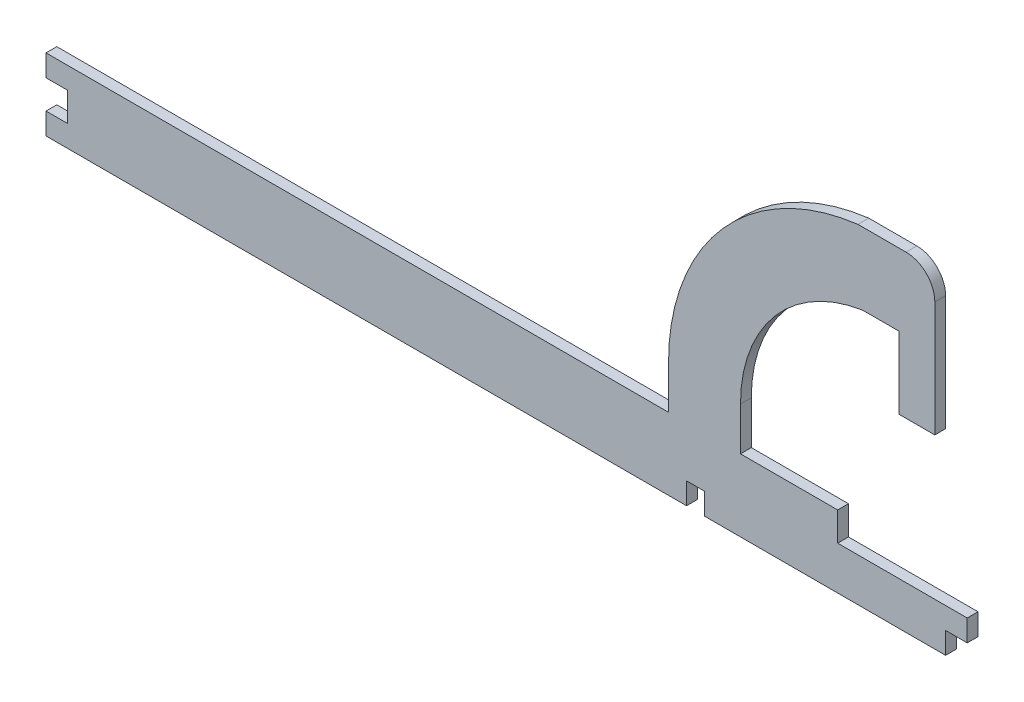
from build123d import *

# Parameters (mm, degrees)
EXTRUDE_1_DEPTH = 3


with BuildPart() as part:
    # Эскиз2 → Бобышка-Вытянуть1 (new body)
    with BuildSketch(Plane.XY):
        with BuildLine():
            Line((0, 0), (172, 0))
            Line((172, 0), (172, 6))
            Line((172, 6), (177, 6))
            Line((177, 6), (177, 0))
            Line((177, 0), (244, 0))
            Line((244, 0), (244, 6))
            Line((244, 6), (250, 6))
            Line((250, 6), (250, 12))
            Line((250, 12), (244, 12))
            Line((244, 12), (214, 12))
            Line((214, 12), (214, 20))
            Line((214, 20), (187, 20))
            Line((187, 20), (187, 32))
            ThreePointArc((187, 32), (196.668498224, 58.076809621), (221, 71.547439867))
            Line((221, 71.547439867), (231, 71.547439867))
            Line((231, 71.547439867), (231, 51.547439867))
            Line((231, 51.547439867), (241, 51.547439867))
            Line((241, 51.547439867), (241, 83.547439867))
            ThreePointArc((241, 83.547439867), (238.656854249, 89.204294116), (233, 91.547439867))
            Line((233, 91.547439867), (219.644566271, 91.547439867))
            ThreePointArc((219.644566271, 91.547439867), (182.048214587, 71.740873017), (167, 32))
            Line((167, 32), (167, 20))
            Line((167, 20), (0, 20))
            Line((0, 20), (-6, 20))
            Line((-6, 20), (-6, 14))
            Line((-6, 14), (0, 14))
            Line((0, 14), (0, 6))
            Line((0, 6), (-6, 6))
            Line((-6, 6), (-6, 0))
            Line((-6, 0), (0, 0))
        make_face()
    extrude(amount=EXTRUDE_1_DEPTH)


solid = part.part
